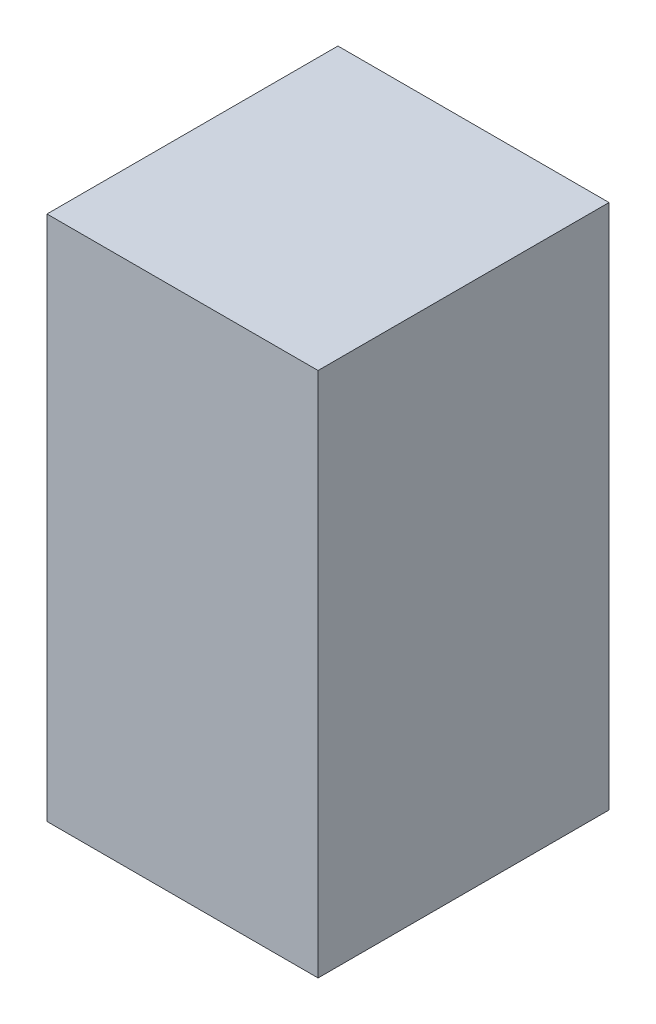
from build123d import *

# Parameters (mm, degrees)
SKETCH1_W           = 241.8
SKETCH1_H           = 259.5
BOSS_EXTRUDE1_DEPTH = 469.26


with BuildPart() as part:
    # Sketch1 → Boss-Extrude1 (new body)
    with BuildSketch(Plane(origin=(0, 0, 0), x_dir=(1, 0, 0), z_dir=(0, 1, 0))):
        with Locations((120.9, 129.75)):
            Rectangle(SKETCH1_W, SKETCH1_H)
    extrude(amount=BOSS_EXTRUDE1_DEPTH)


solid = part.part
